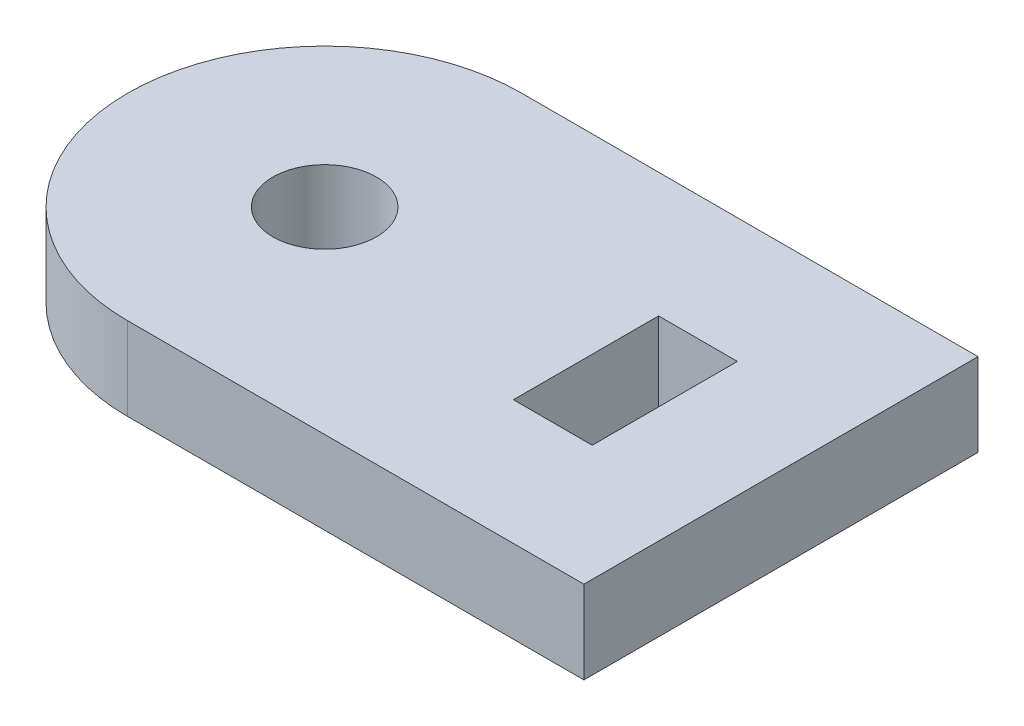
from build123d import *

# Parameters (mm, degrees)
SKETCH1_R           = 2.5
SKETCH1_W           = 3.8
SKETCH1_H           = 7
BOSS_EXTRUDE1_DEPTH = 4


with BuildPart() as part:
    # Sketch1 → Boss-Extrude1 (new body)
    with BuildSketch(Plane(origin=(0, 0, 0), x_dir=(1, 0, 0), z_dir=(0, 1, 0))):
        with BuildLine():
            Line((0, 0), (22, 0))
            Line((22, 0), (22, 19))
            Line((22, 19), (0, 19))
            ThreePointArc((0, 19), (-9.5, 9.5), (0, 0))
        make_face()
        with Locations(Location((0, 9.5, 0), (0, 0, 270))):
            Circle(SKETCH1_R, mode=Mode.SUBTRACT)
        with Locations((14.5, 9.5)):
            Rectangle(SKETCH1_W, SKETCH1_H, mode=Mode.SUBTRACT)
    extrude(amount=BOSS_EXTRUDE1_DEPTH)


solid = part.part
